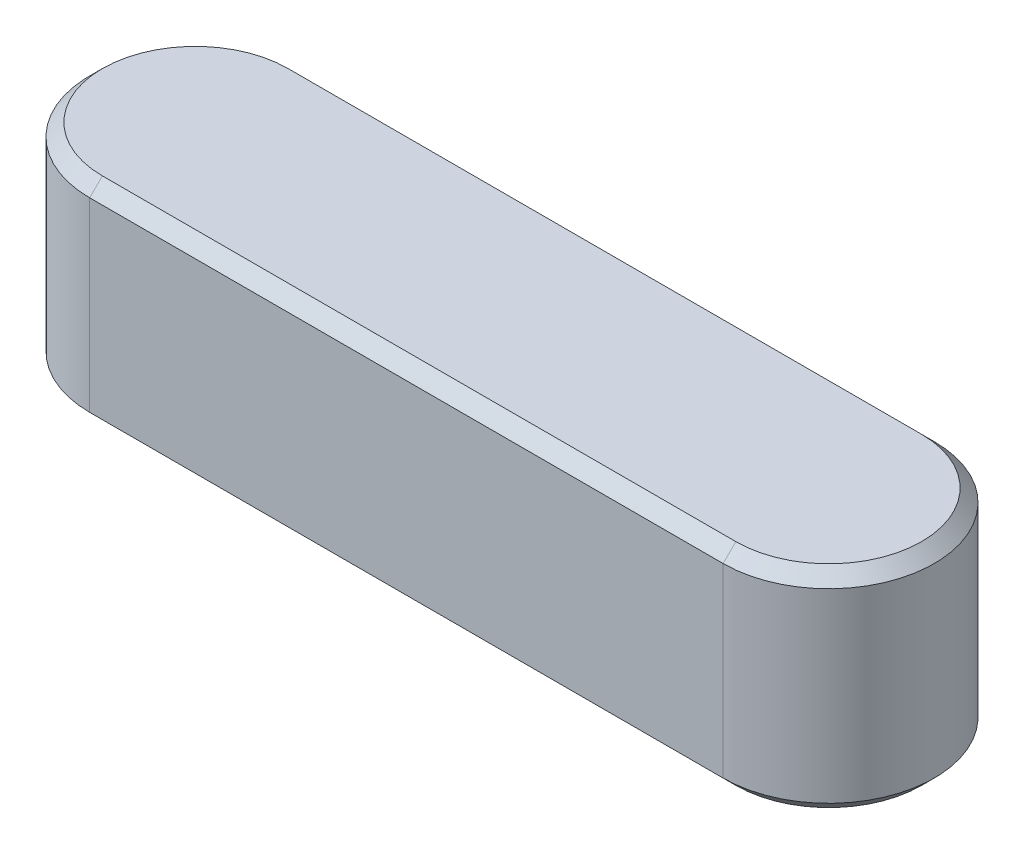
from build123d import *

# Parameters (mm, degrees)
BOSS_EXTRUDE1_DEPTH = 5
CHAMFER1_SIZE       = 0.3


with BuildPart() as part:
    # Sketch1 → Boss-Extrude1 (new body)
    with BuildSketch(Plane(origin=(0, 0, 0), x_dir=(1, 0, 0), z_dir=(0, 1, 0))):
        with BuildLine():
            Line((0, 2.5), (15, 2.5))
            ThreePointArc((15, 2.5), (17.5, 0), (15, -2.5))
            Line((15, -2.5), (0, -2.5))
            ThreePointArc((0, -2.5), (-2.5, 0), (0, 2.5))
        make_face()
    extrude(amount=BOSS_EXTRUDE1_DEPTH)

    # Chamfer1
    chamfer1_edges = [part.edges().sort_by_distance(p)[0] for p in [
        (17.5, 5, 0),
        (7.5, 5, -2.5),
        (-2.5, 5, 0),
        (7.5, 0, -2.5),
        (17.5, 0, 0),
        (7.5, 0, 2.5),
        (-2.5, 0, 0),
        (7.5, 5, 2.5),
    ]]
    chamfer(chamfer1_edges, length=CHAMFER1_SIZE)


solid = part.part
